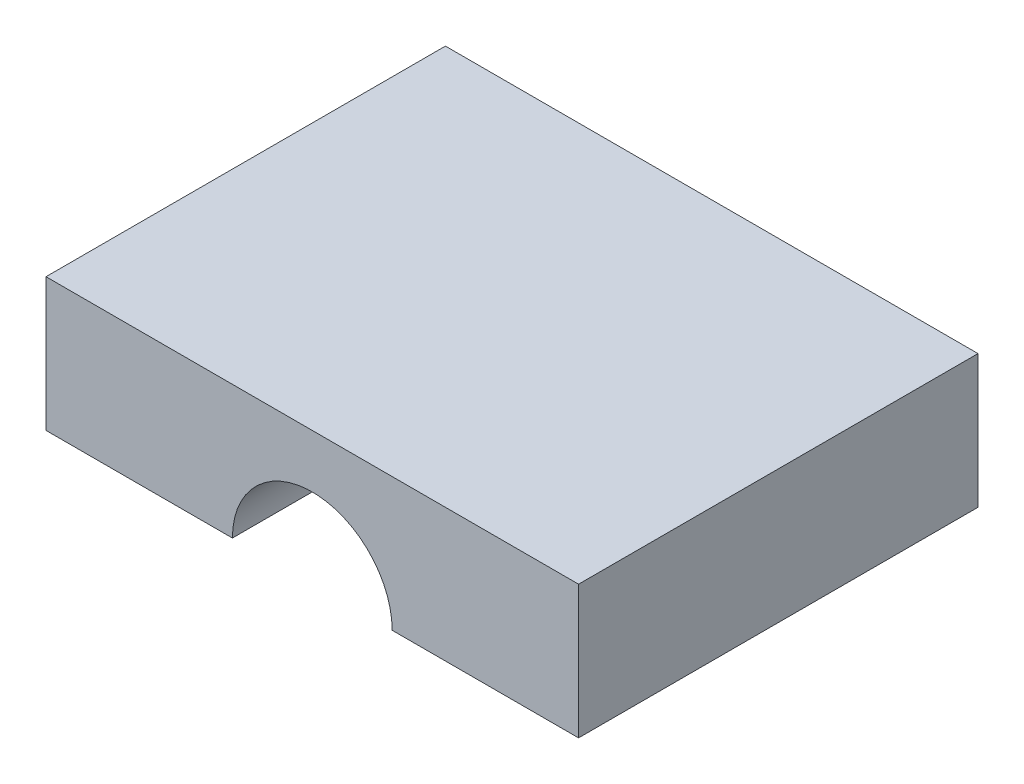
from build123d import *

# Parameters (mm, degrees)
SKETCH_1_W          = 40
SKETCH_1_H          = 30
EXTRUDE_1_DEPTH     = 10
CUT_EXTRUDE_1_DEPTH = 51.990195136


with BuildPart() as part:
    # 草图1 → 凸台-拉伸1 (new body)
    with BuildSketch(Plane(origin=(0, 0, 0), x_dir=(1, 0, 0), z_dir=(0, 1, 0))):
        with Locations((20, 15)):
            Rectangle(SKETCH_1_W, SKETCH_1_H)
    extrude(amount=EXTRUDE_1_DEPTH)

    # 草图2 → 切除-拉伸1 (cut, through all)
    with BuildSketch(Plane.XY):
        with BuildLine():
            Line((14, 0), (26, 0))
            ThreePointArc((26, 0), (20, 6), (14, 0))
        make_face()
    extrude(amount=-CUT_EXTRUDE_1_DEPTH, mode=Mode.SUBTRACT)


solid = part.part
